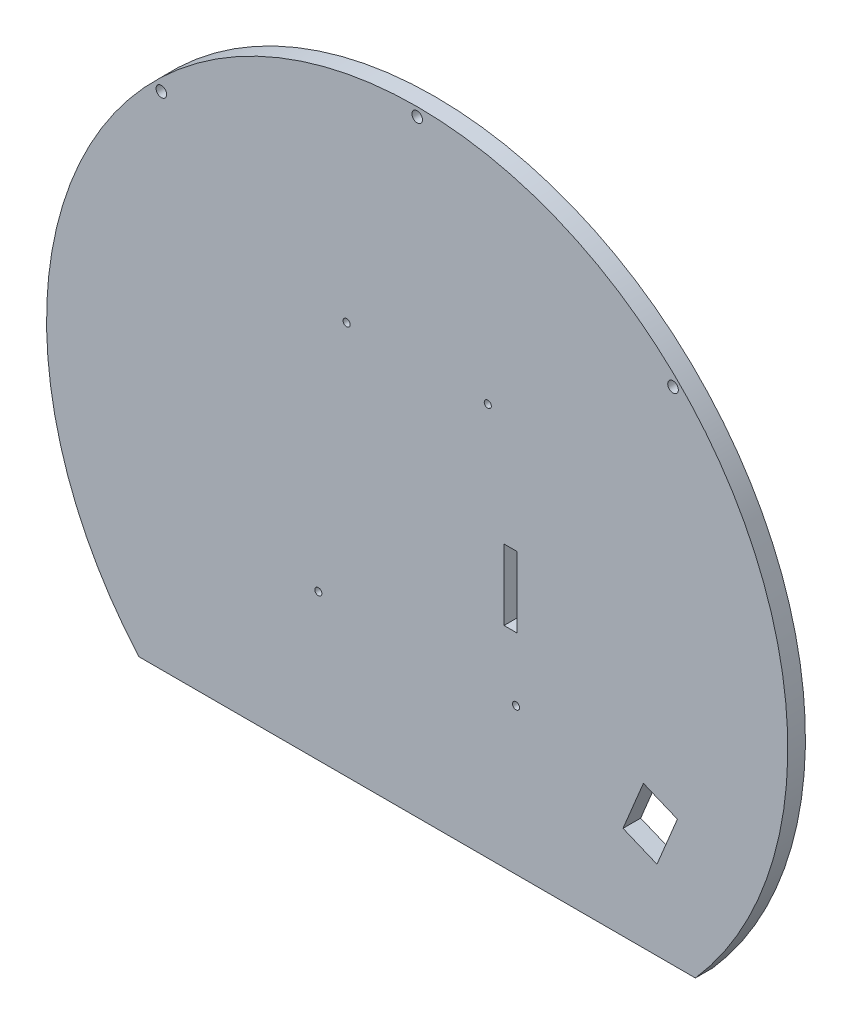
from build123d import *

# Parameters (mm, degrees)
BOSS_EXTRU_1_DEPTH      = 5
ESQUISSE2_R             = 1.5
ENL_V_MAT_EXTRU_1_DEPTH = 5
ESQUISSE3_R             = 1
ENL_V_MAT_EXTRU_2_DEPTH = 149.576579581
ENL_V_MAT_EXTRU_3_DEPTH = 149.576579581
ESQUISSE5_W             = 3.649999998
ESQUISSE5_H             = 20
ENL_V_MAT_EXTRU_4_DEPTH = 149.576579581


with BuildPart() as part:
    # Esquisse1 → Boss.-Extru.1 (new body)
    with BuildSketch(Plane.XY):
        with BuildLine():
            Line((78.81072608, -69.38205427), (-78.81072608, -69.38205427))
            ThreePointArc((-78.81072608, -69.38205427), (0, 105), (78.81072608, -69.38205427))
        make_face()
    extrude(amount=BOSS_EXTRU_1_DEPTH)

    # Esquisse2 → Enlèv. mat.-Extru.1 (cut)
    with BuildSketch(Plane.XY.offset(5)):
        with Locations((0, 102.5)):
            Circle(ESQUISSE2_R)
        with Locations((72.478445072, 72.478445072)):
            Circle(ESQUISSE2_R)
        with Locations((-72.478445072, 72.478445072)):
            Circle(ESQUISSE2_R)
    extrude(amount=-ENL_V_MAT_EXTRU_1_DEPTH, mode=Mode.SUBTRACT)

    # Esquisse3 → Enlèv. mat.-Extru.2 (cut, through all)
    with BuildSketch(Plane.XY.offset(5)):
        with Locations((20.000000004, 41.999999998)):
            Circle(ESQUISSE3_R)
        with Locations((-19.999999996, 42.000000002)):
            Circle(ESQUISSE3_R)
        with Locations((-28.000000003, -27.999999997)):
            Circle(ESQUISSE3_R)
        with Locations((27.999999997, -28.000000003)):
            Circle(ESQUISSE3_R)
    extrude(amount=-ENL_V_MAT_EXTRU_2_DEPTH, mode=Mode.SUBTRACT)

    # Esquisse4 → Enlèv. mat.-Extru.3 (cut, through all)
    with BuildSketch(Plane.XY.offset(5)):
        Polygon((58.312515902, -42.91606585), (64.096555924, -28.967772728), (73.721801907, -32.959143392), (67.937761885, -46.907436514), align=None)
    extrude(amount=-ENL_V_MAT_EXTRU_3_DEPTH, mode=Mode.SUBTRACT)

    # Esquisse5 → Enlèv. mat.-Extru.4 (cut, through all)
    with BuildSketch(Plane.XY.offset(5)):
        with Locations((26.425, -3e-09)):
            Rectangle(ESQUISSE5_W, ESQUISSE5_H)
    extrude(amount=-ENL_V_MAT_EXTRU_4_DEPTH, mode=Mode.SUBTRACT)


solid = part.part
